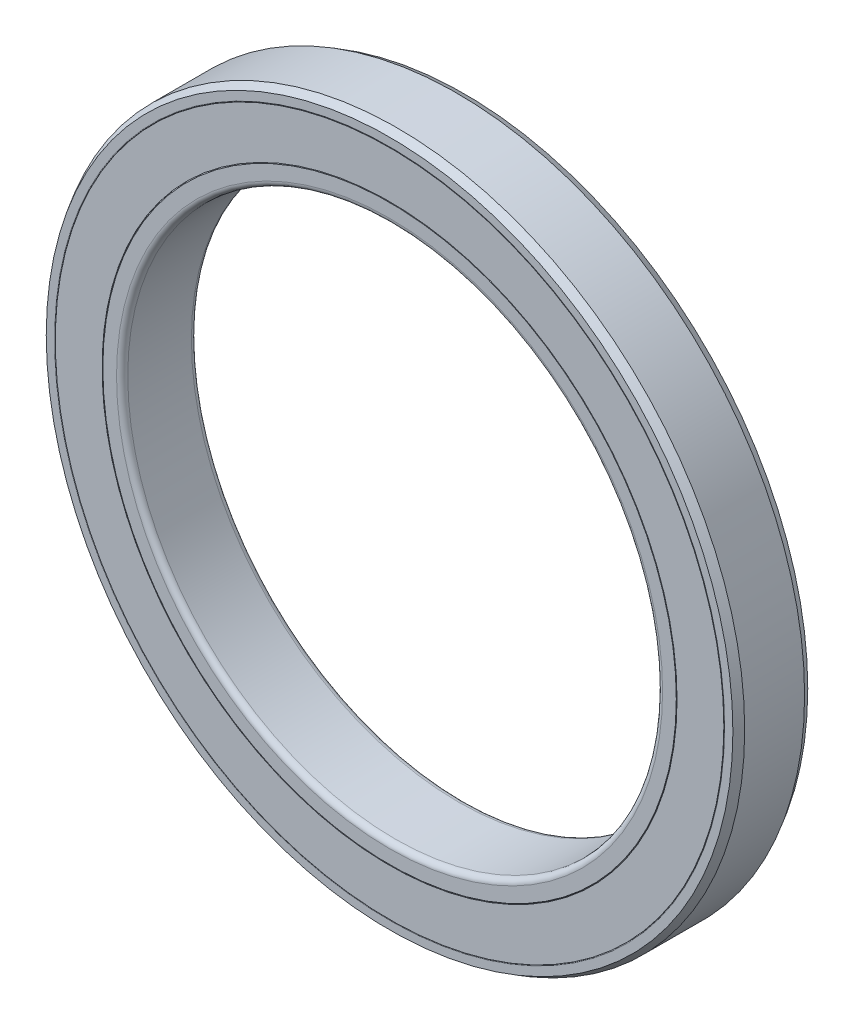
from build123d import *

# Parameters (mm, degrees)
SKETCH4_W         = 0.359375
SKETCH4_H         = 4.375
CIRPATTERN1_COUNT = 7


with BuildPart() as part:
    # Sketch3 → Revolve1 (revolve)
    with BuildSketch(Plane(origin=(0, 0, 0), x_dir=(0, 0, -1), z_dir=(1, 0, 0)), mode=Mode.PRIVATE) as revolve1_sk:
        with BuildLine():
            Line((-2.8, -32.5), (2.8, -32.5))
            Line((2.8, -32.5), (3.5, -32.095854812))
            Line((3.5, -32.095854812), (3.5, -31.32))
            ThreePointArc((3.5, -31.32), (3.479497475, -31.270502525), (3.43, -31.25))
            Line((3.43, -31.25), (2.083333333, -31.25))
            ThreePointArc((2.083333333, -31.25), (0, -32.083333333), (-2.083333333, -31.25))
            Line((-2.083333333, -31.25), (-3.43, -31.25))
            ThreePointArc((-3.43, -31.25), (-3.479497475, -31.270502525), (-3.5, -31.32))
            Line((-3.5, -31.32), (-3.5, -32.095854812))
            Line((-3.5, -32.095854812), (-2.8, -32.5))
        make_face()
        with BuildLine():
            Line((-2.975, -25), (2.975, -25))
            ThreePointArc((2.975, -25), (3.34623106, -25.15376894), (3.5, -25.525))
            Line((3.5, -25.525), (3.5, -26.805))
            Line((3.5, -26.805), (3.43, -26.875))
            Line((3.43, -26.875), (2.083333333, -26.875))
            ThreePointArc((2.083333333, -26.875), (0, -26.041666667), (-2.083333333, -26.875))
            Line((-2.083333333, -26.875), (-3.43, -26.875))
            Line((-3.43, -26.875), (-3.5, -26.805))
            Line((-3.5, -26.805), (-3.5, -25.525))
            ThreePointArc((-3.5, -25.525), (-3.34623106, -25.15376894), (-2.975, -25))
        make_face()
    revolve(revolve1_sk.sketch.rotate(Axis((0, 0, 3.5), (0, 0, -1)), 270), axis=Axis((0, 0, 3.5), (0, 0, -1)))


with BuildPart() as body_2:
    # Sketch4 → Revolve2 (revolve)
    with BuildSketch(Plane(origin=(0, 0, 0), x_dir=(0, 0, -1), z_dir=(1, 0, 0)), mode=Mode.PRIVATE) as revolve2_sk:
        with Locations((-3.3203125, -29.0625)):
            Rectangle(SKETCH4_W, SKETCH4_H)
    revolve(revolve2_sk.sketch.rotate(Axis((0, 0, 3.5), (0, 0, -1)), 270), axis=Axis((0, 0, 3.5), (0, 0, -1)))


with BuildPart() as body_3:
    # Sketch5 → Revolve3 (revolve)
    with BuildSketch(Plane(origin=(0, 0, 0), x_dir=(0, 0, -1), z_dir=(1, 0, 0))):
        with BuildLine():
            Line((0, -26.041666667), (0, -32.083333333))
            ThreePointArc((0, -32.083333333), (-3.020833333, -29.0625), (0, -26.041666667))
        make_face()
    revolve(axis=Axis((0, 0, 0), (0, -1, 0)))


with BuildPart() as cirpattern1_1:
    # CirPattern1: pattern copy
    add(body_3.part.rotate(Axis((0, 0, 0), (0, 0, 1)), 1 * 360 / CIRPATTERN1_COUNT))


with BuildPart() as cirpattern1_2:
    # CirPattern1: pattern copy
    add(body_3.part.rotate(Axis((0, 0, 0), (0, 0, 1)), 2 * 360 / CIRPATTERN1_COUNT))


with BuildPart() as cirpattern1_3:
    # CirPattern1: pattern copy
    add(body_3.part.rotate(Axis((0, 0, 0), (0, 0, 1)), 3 * 360 / CIRPATTERN1_COUNT))


with BuildPart() as cirpattern1_4:
    # CirPattern1: pattern copy
    add(body_3.part.rotate(Axis((0, 0, 0), (0, 0, 1)), 4 * 360 / CIRPATTERN1_COUNT))


with BuildPart() as cirpattern1_5:
    # CirPattern1: pattern copy
    add(body_3.part.rotate(Axis((0, 0, 0), (0, 0, 1)), 5 * 360 / CIRPATTERN1_COUNT))


with BuildPart() as cirpattern1_6:
    # CirPattern1: pattern copy
    add(body_3.part.rotate(Axis((0, 0, 0), (0, 0, 1)), 6 * 360 / CIRPATTERN1_COUNT))


solid = Compound([part.part, body_2.part, body_3.part, cirpattern1_1.part, cirpattern1_2.part, cirpattern1_3.part, cirpattern1_4.part, cirpattern1_5.part, cirpattern1_6.part])
